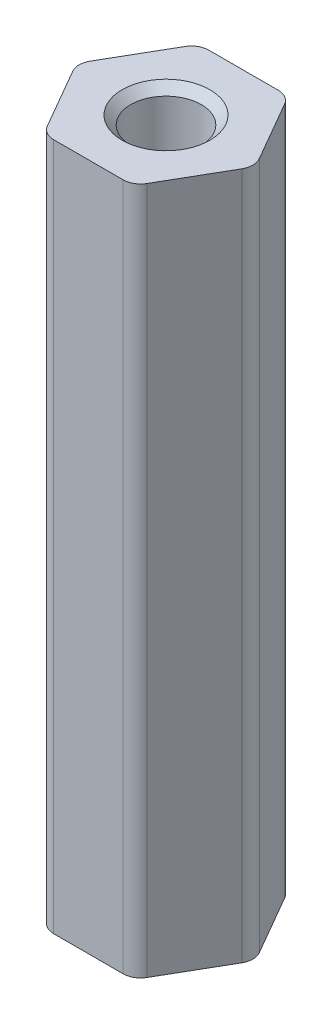
from build123d import *

# Parameters (mm, degrees)
BOSS_EXTRUDE1_DEPTH                = 19.9898
FILLET1_R                          = 0.508
M2_5X0_45_TAPPED_HOLE1_D           = 2.05
M2_5X0_45_TAPPED_HOLE1_CSINK_D     = 2.55
M2_5X0_45_TAPPED_HOLE1_CSINK_ANGLE = 90


with BuildPart() as part:
    # Sketch1 → Boss-Extrude1 (new body)
    with BuildSketch(Plane(origin=(0, 0, 0), x_dir=(1, 0, 0), z_dir=(0, 1, 0))):
        Polygon((-2.6035, 0), (-1.30175, 2.254697139), (1.30175, 2.254697139), (2.6035, 0), (1.30175, -2.254697139), (-1.30175, -2.254697139), align=None)
    extrude(amount=BOSS_EXTRUDE1_DEPTH)

    # Fillet1
    fillet1_edges = [part.edges().sort_by_distance(p)[0] for p in [
        (-2.6035, 9.9949, 0),
        (-1.30175, 9.9949, 2.254697139),
        (1.30175, 9.9949, 2.254697139),
        (2.6035, 9.9949, 0),
        (1.30175, 9.9949, -2.254697139),
        (-1.30175, 9.9949, -2.254697139),
    ]]
    fillet(fillet1_edges, radius=FILLET1_R)

    # M2.5x0.45 Tapped Hole1 (through all)
    with Locations(Plane.ZX.offset(19.9898)):
        with Locations((0, 0)):
            CounterSinkHole(M2_5X0_45_TAPPED_HOLE1_D / 2, M2_5X0_45_TAPPED_HOLE1_CSINK_D / 2, counter_sink_angle=M2_5X0_45_TAPPED_HOLE1_CSINK_ANGLE)


solid = part.part
